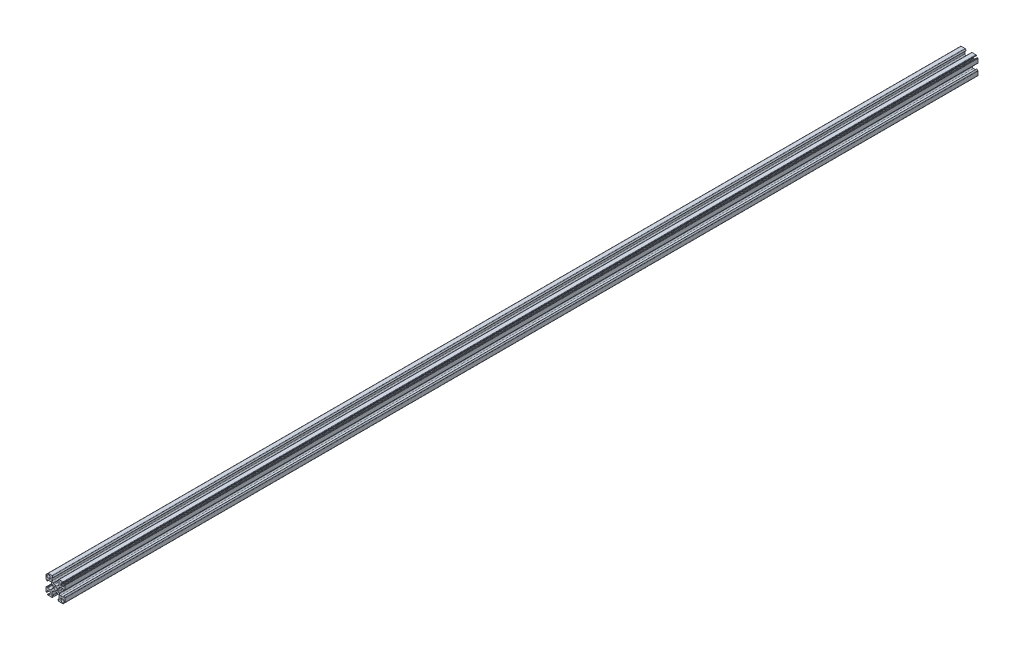
from build123d import *

# Parameters (mm, degrees)
SKETCH1_R           = 2.08
BOSS_EXTRUDE1_DEPTH = 1219.2


with BuildPart() as part:
    # Sketch1 → Boss-Extrude1 (new body)
    with BuildSketch(Plane(origin=(0, 0, 0), x_dir=(-1, 0, 0), z_dir=(0, 0, -1))):
        with BuildLine():
            Line((-7.48853247, 8.61990332), (-6.985643798, 8.117014648))
            ThreePointArc((-6.985643798, 8.117014648), (-6.839197188, 7.763461257), (-6.985643798, 7.409907866))
            Line((-6.985643798, 7.409907866), (-7.409907866, 6.985643798))
            ThreePointArc((-7.409907866, 6.985643798), (-7.763461257, 6.839197188), (-8.117014648, 6.985643798))
            Line((-8.117014648, 6.985643798), (-8.61990332, 7.48853247))
            ThreePointArc((-8.61990332, 7.48853247), (-8.738774884, 7.554957329), (-8.874825936, 7.549228331))
            ThreePointArc((-8.874825936, 7.549228331), (-10.889377278, 7.955008076), (-11.572136222, 9.893284252))
            ThreePointArc((-11.572136222, 9.893284252), (-11.766795458, 10.383720777), (-12.292708824, 10.42656157))
            ThreePointArc((-12.292708824, 10.42656157), (-12.590129525, 10.150252615), (-12.7, 9.759440396))
            Line((-12.7, 9.759440396), (-12.7, 4.710660172))
            ThreePointArc((-12.7, 4.710660172), (-12.642909649, 4.423647598), (-12.480330086, 4.180330086))
            Line((-12.480330086, 4.180330086), (-11.270710678, 2.970710678))
            ThreePointArc((-11.270710678, 2.970710678), (-11.161731657, 2.949033403), (-11.1, 3.041421356))
            Line((-11.1, 3.041421356), (-11.1, 4.325))
            ThreePointArc((-11.1, 4.325), (-10.953553391, 4.678553391), (-10.6, 4.825))
            Line((-10.6, 4.825), (-6.6, 4.825))
            ThreePointArc((-6.6, 4.825), (-5.539339828, 4.385660172), (-5.1, 3.325))
            Line((-5.1, 3.325), (-5.1, 3.15))
            ThreePointArc((-5.1, 3.15), (-4.953553391, 2.796446609), (-4.6, 2.65))
            ThreePointArc((-4.6, 2.65), (-3.892893219, 2.357106781), (-3.6, 1.65))
            Line((-3.6, 1.65), (-3.6, -1.65))
            ThreePointArc((-3.6, -1.65), (-3.892893219, -2.357106781), (-4.6, -2.65))
            ThreePointArc((-4.6, -2.65), (-4.953553391, -2.796446609), (-5.1, -3.15))
            Line((-5.1, -3.15), (-5.1, -3.325))
            ThreePointArc((-5.1, -3.325), (-5.539339828, -4.385660172), (-6.6, -4.825))
            Line((-6.6, -4.825), (-10.6, -4.825))
            ThreePointArc((-10.6, -4.825), (-10.953553391, -4.678553391), (-11.1, -4.325))
            Line((-11.1, -4.325), (-11.1, -3.041421356))
            ThreePointArc((-11.1, -3.041421356), (-11.161731657, -2.949033403), (-11.270710678, -2.970710678))
            Line((-11.270710678, -2.970710678), (-12.480330086, -4.180330086))
            ThreePointArc((-12.480330086, -4.180330086), (-12.642909649, -4.423647598), (-12.7, -4.710660172))
            Line((-12.7, -4.710660172), (-12.7, -9.759440396))
            ThreePointArc((-12.7, -9.759440396), (-12.590129525, -10.150252615), (-12.292708824, -10.42656157))
            ThreePointArc((-12.292708824, -10.42656157), (-11.766795458, -10.383720777), (-11.572136222, -9.893284252))
            ThreePointArc((-11.572136222, -9.893284252), (-10.889377278, -7.955008076), (-8.874825936, -7.549228331))
            ThreePointArc((-8.874825936, -7.549228331), (-8.738774884, -7.554957329), (-8.61990332, -7.48853247))
            Line((-8.61990332, -7.48853247), (-8.117014648, -6.985643798))
            ThreePointArc((-8.117014648, -6.985643798), (-7.763461257, -6.839197188), (-7.409907866, -6.985643798))
            Line((-7.409907866, -6.985643798), (-6.985643798, -7.409907866))
            ThreePointArc((-6.985643798, -7.409907866), (-6.839197188, -7.763461257), (-6.985643798, -8.117014648))
            Line((-6.985643798, -8.117014648), (-7.48853247, -8.61990332))
            ThreePointArc((-7.48853247, -8.61990332), (-7.554957329, -8.738774884), (-7.549228331, -8.874825936))
            ThreePointArc((-7.549228331, -8.874825936), (-7.955008076, -10.889377278), (-9.893284252, -11.572136222))
            ThreePointArc((-9.893284252, -11.572136222), (-10.383720777, -11.766795458), (-10.42656157, -12.292708824))
            ThreePointArc((-10.42656157, -12.292708824), (-10.150252615, -12.590129525), (-9.759440396, -12.7))
            Line((-9.759440396, -12.7), (-4.710660172, -12.7))
            ThreePointArc((-4.710660172, -12.7), (-4.423647598, -12.642909649), (-4.180330086, -12.480330086))
            Line((-4.180330086, -12.480330086), (-2.970710678, -11.270710678))
            ThreePointArc((-2.970710678, -11.270710678), (-2.949033403, -11.161731657), (-3.041421356, -11.1))
            Line((-3.041421356, -11.1), (-4.325, -11.1))
            ThreePointArc((-4.325, -11.1), (-4.678553391, -10.953553391), (-4.825, -10.6))
            Line((-4.825, -10.6), (-4.825, -6.6))
            ThreePointArc((-4.825, -6.6), (-4.385660172, -5.539339828), (-3.325, -5.1))
            Line((-3.325, -5.1), (-3.15, -5.1))
            ThreePointArc((-3.15, -5.1), (-2.796446609, -4.953553391), (-2.65, -4.6))
            ThreePointArc((-2.65, -4.6), (-2.357106781, -3.892893219), (-1.65, -3.6))
            Line((-1.65, -3.6), (1.65, -3.6))
            ThreePointArc((1.65, -3.6), (2.357106781, -3.892893219), (2.65, -4.6))
            ThreePointArc((2.65, -4.6), (2.796446609, -4.953553391), (3.15, -5.1))
            Line((3.15, -5.1), (3.325, -5.1))
            ThreePointArc((3.325, -5.1), (4.385660172, -5.539339828), (4.825, -6.6))
            Line((4.825, -6.6), (4.825, -10.6))
            ThreePointArc((4.825, -10.6), (4.678553391, -10.953553391), (4.325, -11.1))
            Line((4.325, -11.1), (3.041421356, -11.1))
            ThreePointArc((3.041421356, -11.1), (2.949033403, -11.161731657), (2.970710678, -11.270710678))
            Line((2.970710678, -11.270710678), (4.180330086, -12.480330086))
            ThreePointArc((4.180330086, -12.480330086), (4.423647598, -12.642909649), (4.710660172, -12.7))
            Line((4.710660172, -12.7), (9.759440396, -12.7))
            ThreePointArc((9.759440396, -12.7), (10.150252615, -12.590129525), (10.42656157, -12.292708824))
            ThreePointArc((10.42656157, -12.292708824), (10.383720777, -11.766795458), (9.893284252, -11.572136222))
            ThreePointArc((9.893284252, -11.572136222), (7.955008076, -10.889377278), (7.549228331, -8.874825936))
            ThreePointArc((7.549228331, -8.874825936), (7.554957329, -8.738774884), (7.48853247, -8.61990332))
            Line((7.48853247, -8.61990332), (6.985643798, -8.117014648))
            ThreePointArc((6.985643798, -8.117014648), (6.839197188, -7.763461257), (6.985643798, -7.409907866))
            Line((6.985643798, -7.409907866), (7.409907866, -6.985643798))
            ThreePointArc((7.409907866, -6.985643798), (7.763461257, -6.839197188), (8.117014648, -6.985643798))
            Line((8.117014648, -6.985643798), (8.61990332, -7.48853247))
            ThreePointArc((8.61990332, -7.48853247), (8.738774884, -7.554957329), (8.874825936, -7.549228331))
            ThreePointArc((8.874825936, -7.549228331), (10.889377278, -7.955008076), (11.572136222, -9.893284252))
            ThreePointArc((11.572136222, -9.893284252), (11.766795458, -10.383720777), (12.292708824, -10.42656157))
            ThreePointArc((12.292708824, -10.42656157), (12.590129525, -10.150252615), (12.7, -9.759440396))
            Line((12.7, -9.759440396), (12.7, -4.710660172))
            ThreePointArc((12.7, -4.710660172), (12.642909649, -4.423647598), (12.480330086, -4.180330086))
            Line((12.480330086, -4.180330086), (11.270710678, -2.970710678))
            ThreePointArc((11.270710678, -2.970710678), (11.161731657, -2.949033403), (11.1, -3.041421356))
            Line((11.1, -3.041421356), (11.1, -4.325))
            ThreePointArc((11.1, -4.325), (10.953553391, -4.678553391), (10.6, -4.825))
            Line((10.6, -4.825), (6.6, -4.825))
            ThreePointArc((6.6, -4.825), (5.539339828, -4.385660172), (5.1, -3.325))
            Line((5.1, -3.325), (5.1, -3.15))
            ThreePointArc((5.1, -3.15), (4.953553391, -2.796446609), (4.6, -2.65))
            ThreePointArc((4.6, -2.65), (3.892893219, -2.357106781), (3.6, -1.65))
            Line((3.6, -1.65), (3.6, 1.65))
            ThreePointArc((3.6, 1.65), (3.892893219, 2.357106781), (4.6, 2.65))
            ThreePointArc((4.6, 2.65), (4.953553391, 2.796446609), (5.1, 3.15))
            Line((5.1, 3.15), (5.1, 3.325))
            ThreePointArc((5.1, 3.325), (5.539339828, 4.385660172), (6.6, 4.825))
            Line((6.6, 4.825), (10.6, 4.825))
            ThreePointArc((10.6, 4.825), (10.953553391, 4.678553391), (11.1, 4.325))
            Line((11.1, 4.325), (11.1, 3.041421356))
            ThreePointArc((11.1, 3.041421356), (11.161731657, 2.949033403), (11.270710678, 2.970710678))
            Line((11.270710678, 2.970710678), (12.480330086, 4.180330086))
            ThreePointArc((12.480330086, 4.180330086), (12.642909649, 4.423647598), (12.7, 4.710660172))
            Line((12.7, 4.710660172), (12.7, 9.759440396))
            ThreePointArc((12.7, 9.759440396), (12.590129525, 10.150252615), (12.292708824, 10.42656157))
            ThreePointArc((12.292708824, 10.42656157), (11.766795458, 10.383720777), (11.572136222, 9.893284252))
            ThreePointArc((11.572136222, 9.893284252), (10.889377278, 7.955008076), (8.874825936, 7.549228331))
            ThreePointArc((8.874825936, 7.549228331), (8.738774884, 7.554957329), (8.61990332, 7.48853247))
            Line((8.61990332, 7.48853247), (8.117014648, 6.985643798))
            ThreePointArc((8.117014648, 6.985643798), (7.763461257, 6.839197188), (7.409907866, 6.985643798))
            Line((7.409907866, 6.985643798), (6.985643798, 7.409907866))
            ThreePointArc((6.985643798, 7.409907866), (6.839197188, 7.763461257), (6.985643798, 8.117014648))
            Line((6.985643798, 8.117014648), (7.48853247, 8.61990332))
            ThreePointArc((7.48853247, 8.61990332), (7.554957329, 8.738774884), (7.549228331, 8.874825936))
            ThreePointArc((7.549228331, 8.874825936), (7.955008076, 10.889377278), (9.893284252, 11.572136222))
            ThreePointArc((9.893284252, 11.572136222), (10.383720777, 11.766795458), (10.42656157, 12.292708824))
            ThreePointArc((10.42656157, 12.292708824), (10.150252615, 12.590129525), (9.759440396, 12.7))
            Line((9.759440396, 12.7), (4.710660172, 12.7))
            ThreePointArc((4.710660172, 12.7), (4.423647598, 12.642909649), (4.180330086, 12.480330086))
            Line((4.180330086, 12.480330086), (2.970710678, 11.270710678))
            ThreePointArc((2.970710678, 11.270710678), (2.949033403, 11.161731657), (3.041421356, 11.1))
            Line((3.041421356, 11.1), (4.325, 11.1))
            ThreePointArc((4.325, 11.1), (4.678553391, 10.953553391), (4.825, 10.6))
            Line((4.825, 10.6), (4.825, 6.6))
            ThreePointArc((4.825, 6.6), (4.385660172, 5.539339828), (3.325, 5.1))
            Line((3.325, 5.1), (3.15, 5.1))
            ThreePointArc((3.15, 5.1), (2.796446609, 4.953553391), (2.65, 4.6))
            ThreePointArc((2.65, 4.6), (2.357106781, 3.892893219), (1.65, 3.6))
            Line((1.65, 3.6), (-1.65, 3.6))
            ThreePointArc((-1.65, 3.6), (-2.357106781, 3.892893219), (-2.65, 4.6))
            ThreePointArc((-2.65, 4.6), (-2.796446609, 4.953553391), (-3.15, 5.1))
            Line((-3.15, 5.1), (-3.325, 5.1))
            ThreePointArc((-3.325, 5.1), (-4.385660172, 5.539339828), (-4.825, 6.6))
            Line((-4.825, 6.6), (-4.825, 10.6))
            ThreePointArc((-4.825, 10.6), (-4.678553391, 10.953553391), (-4.325, 11.1))
            Line((-4.325, 11.1), (-3.041421356, 11.1))
            ThreePointArc((-3.041421356, 11.1), (-2.949033403, 11.161731657), (-2.970710678, 11.270710678))
            Line((-2.970710678, 11.270710678), (-4.180330086, 12.480330086))
            ThreePointArc((-4.180330086, 12.480330086), (-4.423647598, 12.642909649), (-4.710660172, 12.7))
            Line((-4.710660172, 12.7), (-9.759440396, 12.7))
            ThreePointArc((-9.759440396, 12.7), (-10.150252615, 12.590129525), (-10.42656157, 12.292708824))
            ThreePointArc((-10.42656157, 12.292708824), (-10.383720777, 11.766795458), (-9.893284252, 11.572136222))
            ThreePointArc((-9.893284252, 11.572136222), (-7.955008076, 10.889377278), (-7.549228331, 8.874825936))
            ThreePointArc((-7.549228331, 8.874825936), (-7.554957329, 8.738774884), (-7.48853247, 8.61990332))
        make_face()
        Circle(SKETCH1_R, mode=Mode.SUBTRACT)
    extrude(amount=-BOSS_EXTRUDE1_DEPTH)


solid = part.part
